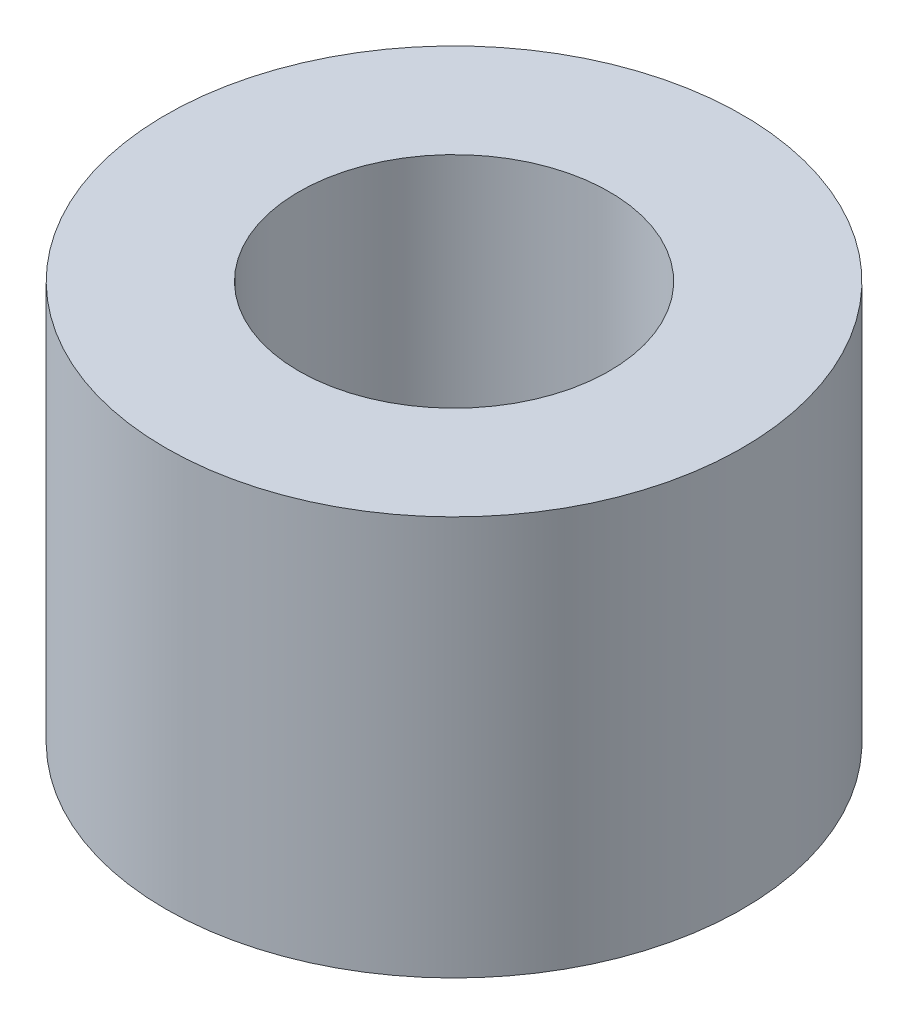
from build123d import *

# Parameters (mm, degrees)
SKETCH_1_R      = 3.25
SKETCH_1_R_2    = 1.75
EXTRUDE_1_DEPTH = 4.5


with BuildPart() as part:
    # 草图1 → 凸台-拉伸1 (new body)
    with BuildSketch(Plane(origin=(0, 0, 0), x_dir=(1, 0, 0), z_dir=(0, 1, 0))):
        with Locations(Location((0, 0, 0), (0, 0, 270))):
            Circle(SKETCH_1_R)
        with Locations(Location((0, 0, 0), (0, 0, 270))):
            Circle(SKETCH_1_R_2, mode=Mode.SUBTRACT)
    extrude(amount=EXTRUDE_1_DEPTH)


solid = part.part
